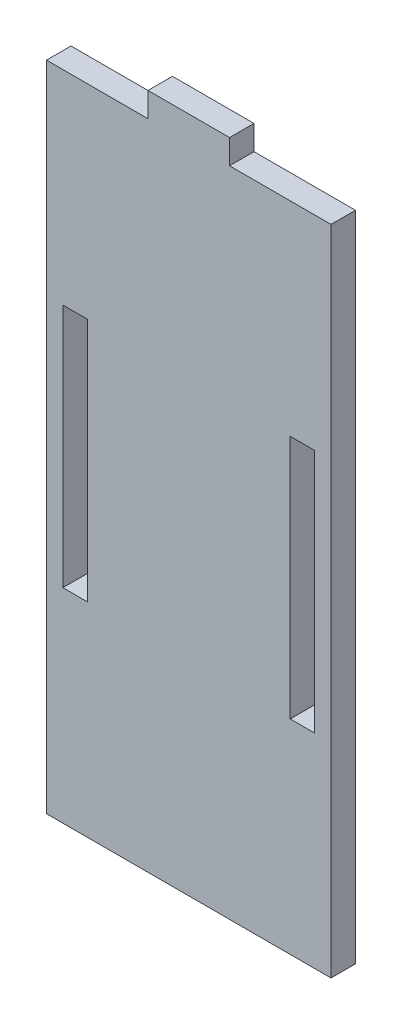
from build123d import *

# Parameters (mm, degrees)
EXTRUDE_1_DEPTH = 3


with BuildPart() as part:
    # 草图1 → 凸台-拉伸1 (new body)
    with BuildSketch(Plane.XY):
        Polygon((0, 0), (0, -40), (2, -40), (2, -25), (5, -25), (5, -40), (17.435, -40), (17.435, 0), (12.435, 0), align=None)
        Polygon((2, -40), (0, -40), (0, -80), (17.435, -80), (17.435, -40), (5, -40), (5, -55), (2, -55), align=None)
        Polygon((17.435, -40), (17.435, -80), (34.87, -80), (34.87, -40), (32.87, -40), (32.87, -55), (29.87, -55), (29.87, -40), align=None)
        Polygon((17.435, 0), (17.435, -40), (29.87, -40), (29.87, -25), (32.87, -25), (32.87, -40), (34.87, -40), (34.87, 0), (22.435, 0), align=None)
        Polygon((12.435, 3), (12.435, 0), (17.435, 0), (22.435, 0), (22.435, 3), align=None)
    extrude(amount=EXTRUDE_1_DEPTH)


solid = part.part
